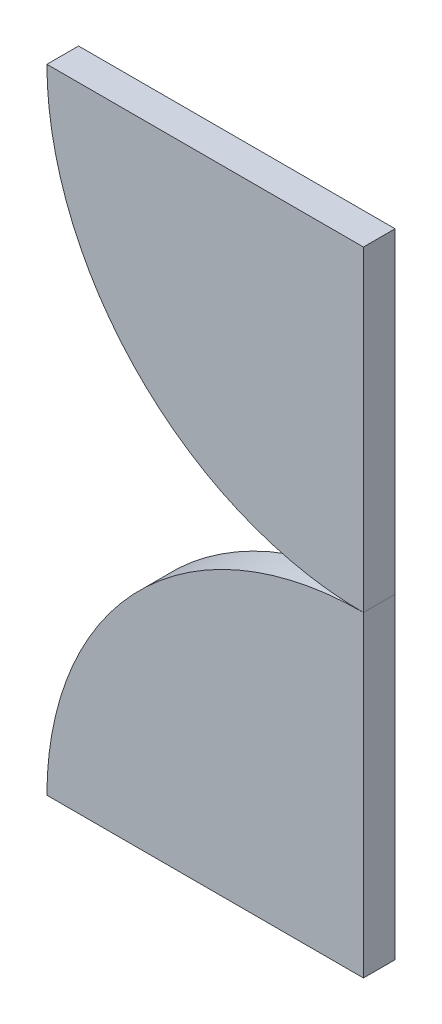
from build123d import *

# Parameters (mm, degrees)
EXTRUDE_1_DEPTH   = 1
EXTRUDE_1_2_DEPTH = 1


with BuildPart() as part:
    # ｽｹｯﾁ1 → ﾎﾞｽ - 押し出し1 (new body)
    with BuildSketch(Plane.XY):
        with BuildLine():
            Line((0, -10), (0, 0))
            Line((0, 0), (-10, 0))
            ThreePointArc((-10, 0), (-7.071067812, -7.071067812), (0, -10))
        make_face()
    extrude(amount=EXTRUDE_1_DEPTH)


with BuildPart() as body_2:
    # ｽｹｯﾁ1 → Extrude 1 2 (new body)
    with BuildSketch(Plane.XY):
        with BuildLine():
            Line((0, -20), (0, -10))
            ThreePointArc((0, -10), (-7.071067812, -12.928932188), (-10, -20))
            Line((-10, -20), (0, -20))
        make_face()
    extrude(amount=EXTRUDE_1_2_DEPTH)


solid = Compound([part.part, body_2.part])
